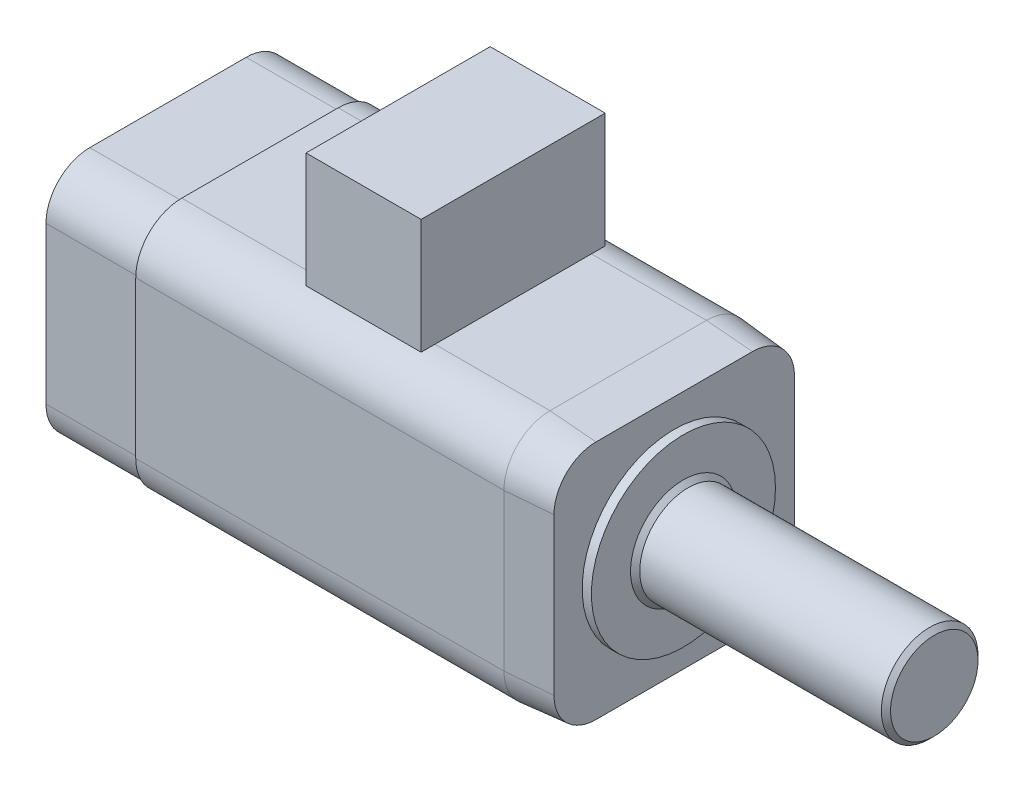
from build123d import *

# Parameters (mm, degrees)
EXTRUDE_1_DEPTH = 20
EXTRUDE_1_TAPER = 5
SKETCH_2_R      = 40
EXTRUDE_2_DEPTH = 4
SKETCH_3_R      = 21
EXTRUDE_3_DEPTH = 109
CHAMFER_1_SIZE  = 2
CHAMFER_2_SIZE  = 2
EXTRUDE_5_DEPTH = 160
SKETCH_7_W      = 50
SKETCH_7_H      = 80
EXTRUDE_6_DEPTH = 50
EXTRUDE_7_DEPTH = 40


with BuildPart() as part:
    # 草圖1 → 伸長1 (new body)
    with BuildSketch(Plane(origin=(0, 0, 0), x_dir=(0, 0, -1), z_dir=(1, 0, 0))):
        with BuildLine():
            ThreePointArc((-34, 54), (-48.142135624, 48.142135624), (-54, 34))
            Line((-54, 34), (-54, -34))
            ThreePointArc((-54, -34), (-48.142135624, -48.142135624), (-34, -54))
            Line((-34, -54), (34, -54))
            ThreePointArc((34, -54), (48.142135624, -48.142135624), (54, -34))
            Line((54, -34), (54, 34))
            ThreePointArc((54, 34), (48.142135624, 48.142135624), (34, 54))
            Line((34, 54), (-34, 54))
        make_face()
    extrude(amount=EXTRUDE_1_DEPTH, taper=EXTRUDE_1_TAPER)

    # 草圖2 → 伸長2 (add)
    with BuildSketch(Plane(origin=(20, 0, 0), x_dir=(0, 0, -1), z_dir=(1, 0, 0))):
        Circle(SKETCH_2_R)
    extrude(amount=EXTRUDE_2_DEPTH)

    # 草圖3 → 伸長3 (add)
    with BuildSketch(Plane(origin=(24, 0, 0), x_dir=(0, 0, -1), z_dir=(1, 0, 0))):
        Circle(SKETCH_3_R)
    extrude(amount=EXTRUDE_3_DEPTH)

    # 導角1
    chamfer_1_edges = [part.edges().sort_by_distance(p)[0] for p in [
        (24, 0, 21),
    ]]
    chamfer(chamfer_1_edges, length=CHAMFER_1_SIZE)

    # 導角2
    chamfer_2_edges = [part.edges().sort_by_distance(p)[0] for p in [
        (133, 0, 21),
    ]]
    chamfer(chamfer_2_edges, length=CHAMFER_2_SIZE)

    # 草圖6 → 伸長5 (add)
    with BuildSketch(Plane.ZY):
        with BuildLine():
            Line((-54, 34), (-54, -34))
            ThreePointArc((-54, -34), (-48.142135624, -48.142135624), (-34, -54))
            Line((-34, -54), (34, -54))
            ThreePointArc((34, -54), (48.142135624, -48.142135624), (54, -34))
            Line((54, -34), (54, 34))
            ThreePointArc((54, 34), (48.142135624, 48.142135624), (34, 54))
            Line((34, 54), (-34, 54))
            ThreePointArc((-34, 54), (-48.142135624, 48.142135624), (-54, 34))
        make_face()
    extrude(amount=EXTRUDE_5_DEPTH)

    # 草圖7 → 伸長6 (add)
    with BuildSketch(Plane(origin=(0, 54, 0), x_dir=(1, 0, 0), z_dir=(0, 1, 0))):
        with Locations((-75, 0)):
            Rectangle(SKETCH_7_W, SKETCH_7_H)
    extrude(amount=EXTRUDE_6_DEPTH)

    # 草圖8 → 伸長7 (add)
    with BuildSketch(Plane.ZY.offset(160)):
        with BuildLine():
            Line((-53, 34), (-53, -34))
            ThreePointArc((-53, -34), (-47.435028843, -47.435028843), (-34, -53))
            Line((-34, -53), (34, -53))
            ThreePointArc((34, -53), (47.435028843, -47.435028843), (53, -34))
            Line((53, -34), (53, 34))
            ThreePointArc((53, 34), (47.435028843, 47.435028843), (34, 53))
            Line((34, 53), (-34, 53))
            ThreePointArc((-34, 53), (-47.435028843, 47.435028843), (-53, 34))
        make_face()
    extrude(amount=EXTRUDE_7_DEPTH)


solid = part.part
